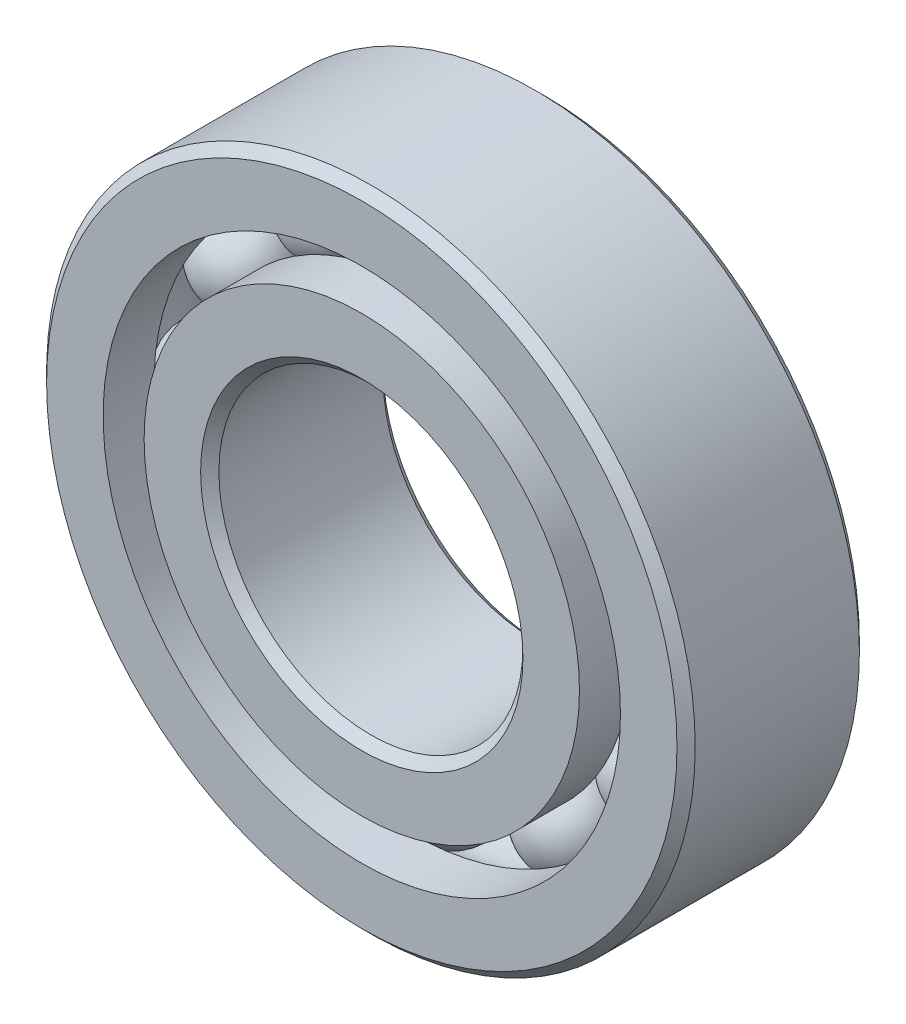
from build123d import *

# Parameters (mm, degrees)
CIRPATTERN1_COUNT = 12


with BuildPart() as part:
    # Sketch1 → Revolve1 (revolve)
    with BuildSketch(Plane(origin=(0, 0, 0), x_dir=(0, 0, -1), z_dir=(1, 0, 0)), mode=Mode.PRIVATE) as revolve1_sk:
        with BuildLine():
            Line((4.05, 16), (-4.05, 16))
            Line((-4.05, 16), (-4.5, 15.55))
            Line((-4.5, 15.55), (-4.5, 12.760989011))
            Line((-4.5, 12.760989011), (-2, 12.760989011))
            ThreePointArc((-2, 12.760989011), (0, 13.991003967), (2, 12.760989011))
            Line((2, 12.760989011), (4.5, 12.760989011))
            Line((4.5, 12.760989011), (4.5, 15.55))
            Line((4.5, 15.55), (4.05, 16))
        make_face()
    revolve(revolve1_sk.sketch.rotate(Axis((0, 0, 4.5), (0, 0, -1)), 90), axis=Axis((0, 0, 4.5), (0, 0, -1)))


with BuildPart() as body_2:
    # Sketch3 → Revolve3 (revolve)
    with BuildSketch(Plane(origin=(0, 0, 0), x_dir=(0, 0, -1), z_dir=(1, 0, 0)), mode=Mode.PRIVATE) as revolve3_sk:
        with BuildLine():
            Line((-4.5, 10.739010989), (-2, 10.739010989))
            ThreePointArc((-2, 10.739010989), (0, 9.508996033), (2, 10.739010989))
            Line((2, 10.739010989), (4.5, 10.739010989))
            Line((4.5, 10.739010989), (4.5, 7.95))
            Line((4.5, 7.95), (4.05, 7.5))
            Line((4.05, 7.5), (-4.05, 7.5))
            Line((-4.05, 7.5), (-4.5, 7.95))
            Line((-4.5, 7.95), (-4.5, 10.739010989))
        make_face()
    revolve(revolve3_sk.sketch.rotate(Axis((0, 0, 4.5), (0, 0, -1)), 90), axis=Axis((0, 0, 4.5), (0, 0, -1)))


with BuildPart() as body_3:
    # Sketch4 → Revolve4 (revolve)
    with BuildSketch(Plane(origin=(0, 0, 0), x_dir=(0, 0, -1), z_dir=(1, 0, 0))):
        with BuildLine():
            Line((-2.241003967, 11.75), (2.241003967, 11.75))
            ThreePointArc((2.241003967, 11.75), (0, 13.991003967), (-2.241003967, 11.75))
        make_face()
    revolve(axis=Axis((0, 11.75, 2.241003967), (0, 0, -1)))


with BuildPart() as cirpattern1_1:
    # CirPattern1: pattern copy
    add(body_3.part.rotate(Axis((0, 0, 0), (0, 0, 1)), 1 * 360 / CIRPATTERN1_COUNT))


with BuildPart() as cirpattern1_2:
    # CirPattern1: pattern copy
    add(body_3.part.rotate(Axis((0, 0, 0), (0, 0, 1)), 2 * 360 / CIRPATTERN1_COUNT))


with BuildPart() as cirpattern1_3:
    # CirPattern1: pattern copy
    add(body_3.part.rotate(Axis((0, 0, 0), (0, 0, 1)), 3 * 360 / CIRPATTERN1_COUNT))


with BuildPart() as cirpattern1_4:
    # CirPattern1: pattern copy
    add(body_3.part.rotate(Axis((0, 0, 0), (0, 0, 1)), 4 * 360 / CIRPATTERN1_COUNT))


with BuildPart() as cirpattern1_5:
    # CirPattern1: pattern copy
    add(body_3.part.rotate(Axis((0, 0, 0), (0, 0, 1)), 5 * 360 / CIRPATTERN1_COUNT))


with BuildPart() as cirpattern1_6:
    # CirPattern1: pattern copy
    add(body_3.part.rotate(Axis((0, 0, 0), (0, 0, 1)), 6 * 360 / CIRPATTERN1_COUNT))


with BuildPart() as cirpattern1_7:
    # CirPattern1: pattern copy
    add(body_3.part.rotate(Axis((0, 0, 0), (0, 0, 1)), 7 * 360 / CIRPATTERN1_COUNT))


with BuildPart() as cirpattern1_8:
    # CirPattern1: pattern copy
    add(body_3.part.rotate(Axis((0, 0, 0), (0, 0, 1)), 8 * 360 / CIRPATTERN1_COUNT))


with BuildPart() as cirpattern1_9:
    # CirPattern1: pattern copy
    add(body_3.part.rotate(Axis((0, 0, 0), (0, 0, 1)), 9 * 360 / CIRPATTERN1_COUNT))


with BuildPart() as cirpattern1_10:
    # CirPattern1: pattern copy
    add(body_3.part.rotate(Axis((0, 0, 0), (0, 0, 1)), 10 * 360 / CIRPATTERN1_COUNT))


with BuildPart() as cirpattern1_11:
    # CirPattern1: pattern copy
    add(body_3.part.rotate(Axis((0, 0, 0), (0, 0, 1)), 11 * 360 / CIRPATTERN1_COUNT))


solid = Compound([part.part, body_2.part, body_3.part, cirpattern1_1.part, cirpattern1_2.part, cirpattern1_3.part, cirpattern1_4.part, cirpattern1_5.part, cirpattern1_6.part, cirpattern1_7.part, cirpattern1_8.part, cirpattern1_9.part, cirpattern1_10.part, cirpattern1_11.part])
